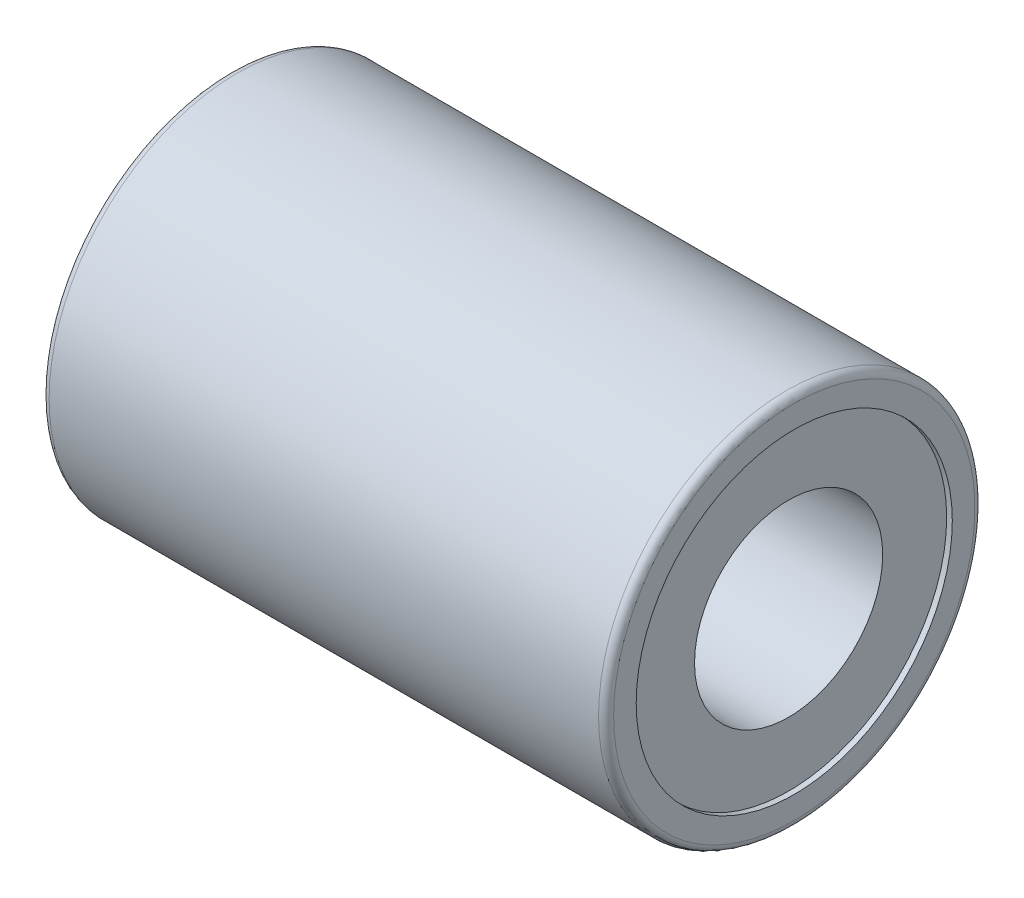
from build123d import *


with BuildPart() as part:
    # Sketch1 → Revolve1 (revolve)
    with BuildSketch(Plane(origin=(0, 0, 0), x_dir=(-1, 0, 0), z_dir=(0, 0, -1)), mode=Mode.PRIVATE) as revolve1_sk:
        with BuildLine():
            Line((5.84, 4), (-5.84, 4))
            ThreePointArc((-5.84, 4), (-5.953137085, 3.953137085), (-6, 3.84))
            Line((-6, 3.84), (-6, 3.36))
            Line((-6, 3.36), (-5.88, 3.36))
            Line((-5.88, 3.36), (-5.88, 2))
            Line((-5.88, 2), (5.88, 2))
            Line((5.88, 2), (5.88, 3.36))
            Line((5.88, 3.36), (6, 3.36))
            Line((6, 3.36), (6, 3.84))
            ThreePointArc((6, 3.84), (5.953137085, 3.953137085), (5.84, 4))
        make_face()
    revolve(revolve1_sk.sketch.rotate(Axis((6, 0, 0), (-1, 0, 0)), 270), axis=Axis((6, 0, 0), (-1, 0, 0)))


solid = part.part
